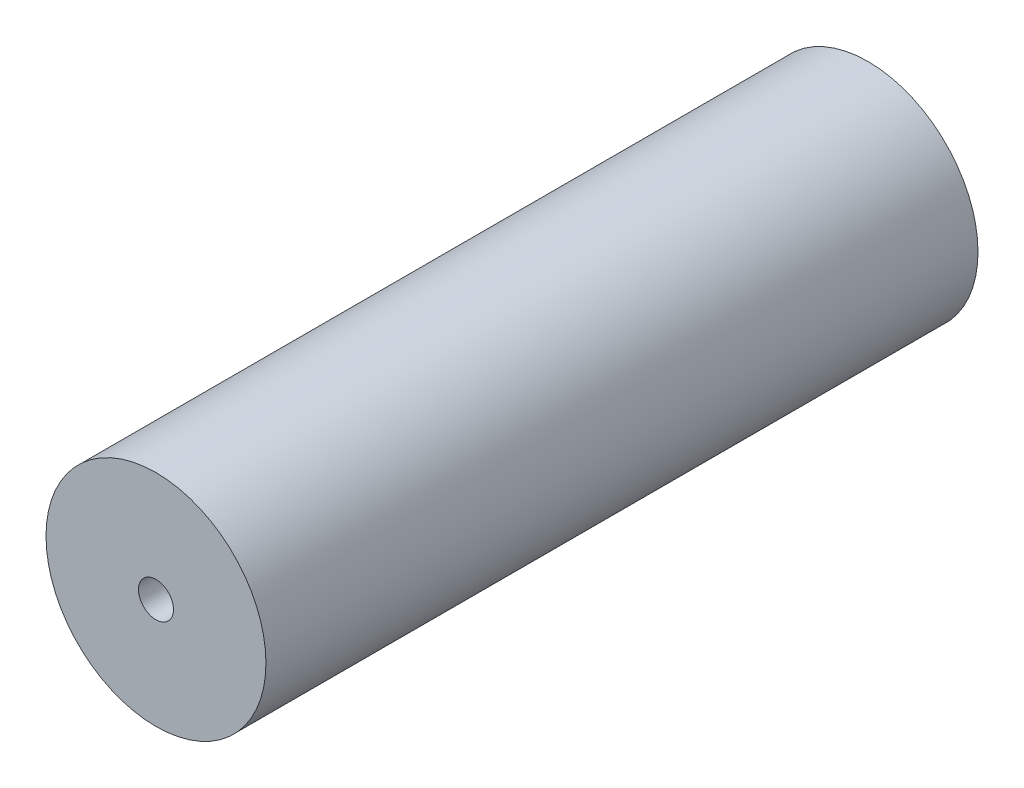
from build123d import *

# Parameters (mm, degrees)
SKETCH1_R              = 12.7
SKETCH1_R_2            = 2.0193
BOSS_EXTRUDE1_DEPTH    = 82.2325
F_10_32_TAPPED_HOLE1_D = 4.0386
F_10_32_TAPPED_HOLE2_D = 4.0386


with BuildPart() as part:
    # Sketch1 → Boss-Extrude1 (new body)
    with BuildSketch(Plane.XY):
        Circle(SKETCH1_R)
        Circle(SKETCH1_R_2, mode=Mode.SUBTRACT)
    extrude(amount=BOSS_EXTRUDE1_DEPTH)

    # #10-32 Tapped Hole1 (through all)
    with Locations(Plane.XY.offset(82.2325)):
        with Locations((0, 0)):
            Hole(F_10_32_TAPPED_HOLE1_D / 2)

    # #10-32 Tapped Hole2 (through all)
    with Locations(Plane(origin=(0, 0, 0), x_dir=(-1, 0, 0), z_dir=(0, 0, -1))):
        with Locations((0, 0)):
            Hole(F_10_32_TAPPED_HOLE2_D / 2)


solid = part.part
